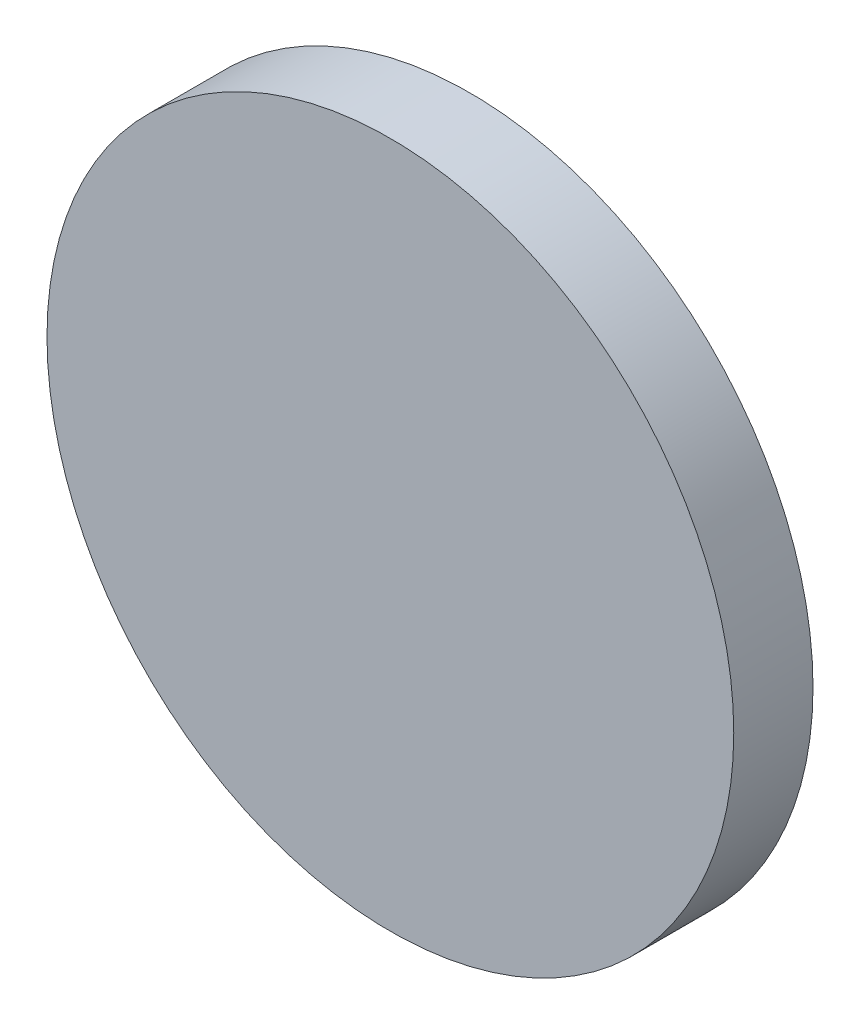
from build123d import *

# Parameters (mm, degrees)
SKETCH1_R           = 41.275
BOSS_EXTRUDE1_DEPTH = 9.525


with BuildPart() as part:
    # Sketch1 → Boss-Extrude1 (new body)
    with BuildSketch(Plane.XY):
        with Locations(Location((0, 0, 0), (0, 0, 180))):
            Circle(SKETCH1_R)
    extrude(amount=BOSS_EXTRUDE1_DEPTH)


solid = part.part
